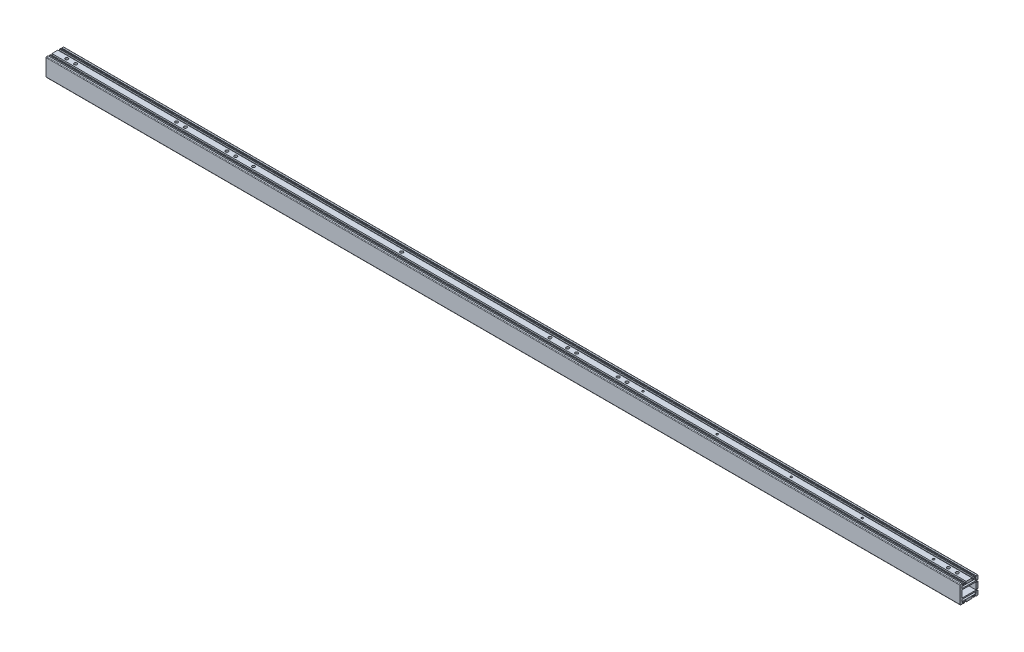
from build123d import *

# Parameters (mm, degrees)
SKETCH_1_W             = 23.5
SKETCH_1_H             = 12
EXTRUDE_1_DEPTH        = 771
HOLE_WIZARD_M6_1_D     = 5
HOLE_WIZARD_M6_1_DEPTH = 15
HOLE_WIZARD_M6_1_TIP   = 1.502151548
HOLE_WIZARD_M6_2_D     = 5
HOLE_WIZARD_M6_2_DEPTH = 15
HOLE_WIZARD_M6_2_TIP   = 1.502151548
HOLE_WIZARD_M4_1_D     = 3.3
HOLE_WIZARD_M4_1_DEPTH = 10.1
HOLE_WIZARD_M4_1_TIP   = 0.991420021
HOLE_WIZARD_M4_2_D     = 3.3
HOLE_WIZARD_M4_2_DEPTH = 10.1
HOLE_WIZARD_M4_2_TIP   = 0.991420021
HOLE_WIZARD_M6_3_D     = 5
HOLE_WIZARD_M6_3_DEPTH = 15
HOLE_WIZARD_M6_3_TIP   = 1.502151548


with BuildPart() as part:
    # 草图1 → 凸台-拉伸1 (new, symmetric)
    with BuildSketch(Plane(origin=(0, 0, 0), x_dir=(0, 0, -1), z_dir=(1, 0, 0))):
        with BuildLine():
            Line((-14, 15), (-11.5, 15))
            Line((-11.5, 15), (-11.5, 13.5))
            Line((-11.5, 13.5), (-11.4, 13.5))
            ThreePointArc((-11.4, 13.5), (-11.117157288, 13.382842712), (-11, 13.1))
            Line((-11, 13.1), (-11, 12))
            Line((-11, 12), (-9.5, 12))
            Line((-9.5, 12), (-9.5, 15))
            Line((-9.5, 15), (-8, 15))
            Line((-8, 15), (-8, 12.5))
            Line((-8, 12.5), (-5, 12.5))
            Line((-5, 12.5), (-5, 15))
            Line((-5, 15), (5, 15))
            Line((5, 15), (5, 12.5))
            Line((5, 12.5), (8, 12.5))
            Line((8, 12.5), (8, 15))
            Line((8, 15), (9.5, 15))
            Line((9.5, 15), (9.5, 12))
            Line((9.5, 12), (11, 12))
            Line((11, 12), (11, 13.1))
            ThreePointArc((11, 13.1), (11.117157288, 13.382842712), (11.4, 13.5))
            Line((11.4, 13.5), (11.5, 13.5))
            Line((11.5, 13.5), (11.5, 15))
            Line((11.5, 15), (14, 15))
            ThreePointArc((14, 15), (14.707106781, 14.707106781), (15, 14))
            Line((15, 14), (15, 8))
            Line((15, 8), (12.5, 8))
            Line((12.5, 8), (12.5, 5))
            Line((12.5, 5), (15, 5))
            Line((15, 5), (15, -5))
            Line((15, -5), (12.5, -5))
            Line((12.5, -5), (12.5, -8))
            Line((12.5, -8), (15, -8))
            Line((15, -8), (15, -14))
            ThreePointArc((15, -14), (14.707106781, -14.707106781), (14, -15))
            Line((14, -15), (11.5, -15))
            Line((11.5, -15), (11.5, -13.5))
            Line((11.5, -13.5), (11.4, -13.5))
            ThreePointArc((11.4, -13.5), (11.117157288, -13.382842712), (11, -13.1))
            Line((11, -13.1), (11, -12))
            Line((11, -12), (9.5, -12))
            Line((9.5, -12), (9.5, -15))
            Line((9.5, -15), (8, -15))
            Line((8, -15), (8, -12.5))
            Line((8, -12.5), (5, -12.5))
            Line((5, -12.5), (5, -15))
            Line((5, -15), (-5, -15))
            Line((-5, -15), (-5, -12.5))
            Line((-5, -12.5), (-8, -12.5))
            Line((-8, -12.5), (-8, -15))
            Line((-8, -15), (-9.5, -15))
            Line((-9.5, -15), (-9.5, -12))
            Line((-9.5, -12), (-11, -12))
            Line((-11, -12), (-11, -13.1))
            ThreePointArc((-11, -13.1), (-11.117157288, -13.382842712), (-11.4, -13.5))
            Line((-11.4, -13.5), (-11.5, -13.5))
            Line((-11.5, -13.5), (-11.5, -15))
            Line((-11.5, -15), (-14, -15))
            ThreePointArc((-14, -15), (-14.707106781, -14.707106781), (-15, -14))
            Line((-15, -14), (-15, 14))
            ThreePointArc((-15, 14), (-14.707106781, 14.707106781), (-14, 15))
        make_face()
        with BuildLine():
            Line((12, -10.5), (12, -8.5))
            ThreePointArc((12, -8.5), (11.853553391, -8.146446609), (11.5, -8))
            Line((11.5, -8), (-11.5, -8))
            ThreePointArc((-11.5, -8), (-11.853553391, -8.146446609), (-12, -8.5))
            Line((-12, -8.5), (-12, -10.5))
            ThreePointArc((-12, -10.5), (-11.853553391, -10.853553391), (-11.5, -11))
            Line((-11.5, -11), (11.5, -11))
            ThreePointArc((11.5, -11), (11.853553391, -10.853553391), (12, -10.5))
        make_face(mode=Mode.SUBTRACT)
        with BuildLine():
            Line((-11.5, 11), (11.5, 11))
            ThreePointArc((11.5, 11), (11.853553391, 10.853553391), (12, 10.5))
            Line((12, 10.5), (12, 8.5))
            ThreePointArc((12, 8.5), (11.853553391, 8.146446609), (11.5, 8))
            Line((11.5, 8), (-11.5, 8))
            ThreePointArc((-11.5, 8), (-11.853553391, 8.146446609), (-12, 8.5))
            Line((-12, 8.5), (-12, 10.5))
            ThreePointArc((-12, 10.5), (-11.853553391, 10.853553391), (-11.5, 11))
        make_face(mode=Mode.SUBTRACT)
        Rectangle(SKETCH_1_W, SKETCH_1_H, mode=Mode.SUBTRACT)
    extrude(amount=EXTRUDE_1_DEPTH, both=True)

    # M6 螺纹孔1
    with Locations(Plane(origin=(0, 15, 0), x_dir=(-1, 0, 0), z_dir=(0, 1, 0))):
        with Locations((-751, 0), (-736, 0), (-194, 0), (-179, 0), (-109, 0), (-94, 0), (466, 0), (481, 0), (551, 0), (566, 0), (736, 0), (751, 0)):
            Hole(HOLE_WIZARD_M6_1_D / 2, depth=HOLE_WIZARD_M6_1_DEPTH)
            with Locations((0, 0, -(HOLE_WIZARD_M6_1_DEPTH + HOLE_WIZARD_M6_1_TIP / 2))):  # 118° drill point
                Cone(0, HOLE_WIZARD_M6_1_D / 2, HOLE_WIZARD_M6_1_TIP, mode=Mode.SUBTRACT)

    # M6 螺纹孔2
    with Locations(Plane.XZ.offset(15)):
        with Locations((-751, 0), (-736, 0), (751, 0), (736, 0)):
            Hole(HOLE_WIZARD_M6_2_D / 2, depth=HOLE_WIZARD_M6_2_DEPTH)
            with Locations((0, 0, -(HOLE_WIZARD_M6_2_DEPTH + HOLE_WIZARD_M6_2_TIP / 2))):  # 118° drill point
                Cone(0, HOLE_WIZARD_M6_2_D / 2, HOLE_WIZARD_M6_2_TIP, mode=Mode.SUBTRACT)

    # M4 螺纹孔1
    with Locations(Plane(origin=(0, 15, 0), x_dir=(-1, 0, 0), z_dir=(0, 1, 0))):
        with Locations((-711, 0), (-591, 0), (-471, 0), (-346, 0), (-221, 0)):
            Hole(HOLE_WIZARD_M4_1_D / 2, depth=HOLE_WIZARD_M4_1_DEPTH)
            with Locations((0, 0, -(HOLE_WIZARD_M4_1_DEPTH + HOLE_WIZARD_M4_1_TIP / 2))):  # 118° drill point
                Cone(0, HOLE_WIZARD_M4_1_D / 2, HOLE_WIZARD_M4_1_TIP, mode=Mode.SUBTRACT)

    # M4 螺纹孔2
    with Locations(Plane(origin=(0, 0, -15), x_dir=(-1, 0, 0), z_dir=(0, 0, -1))):
        with Locations((741, 0), (651, 0), (561, 0)):
            Hole(HOLE_WIZARD_M4_2_D / 2, depth=HOLE_WIZARD_M4_2_DEPTH)
            with Locations((0, 0, -(HOLE_WIZARD_M4_2_DEPTH + HOLE_WIZARD_M4_2_TIP / 2))):  # 118° drill point
                Cone(0, HOLE_WIZARD_M4_2_D / 2, HOLE_WIZARD_M4_2_TIP, mode=Mode.SUBTRACT)

    # M6 螺纹孔3
    with Locations(Plane(origin=(0, 15, 0), x_dir=(-1, 0, 0), z_dir=(0, 1, 0))):
        with Locations((436, 0), (186, 0), (-64, 0)):
            Hole(HOLE_WIZARD_M6_3_D / 2, depth=HOLE_WIZARD_M6_3_DEPTH)
            with Locations((0, 0, -(HOLE_WIZARD_M6_3_DEPTH + HOLE_WIZARD_M6_3_TIP / 2))):  # 118° drill point
                Cone(0, HOLE_WIZARD_M6_3_D / 2, HOLE_WIZARD_M6_3_TIP, mode=Mode.SUBTRACT)


solid = part.part
